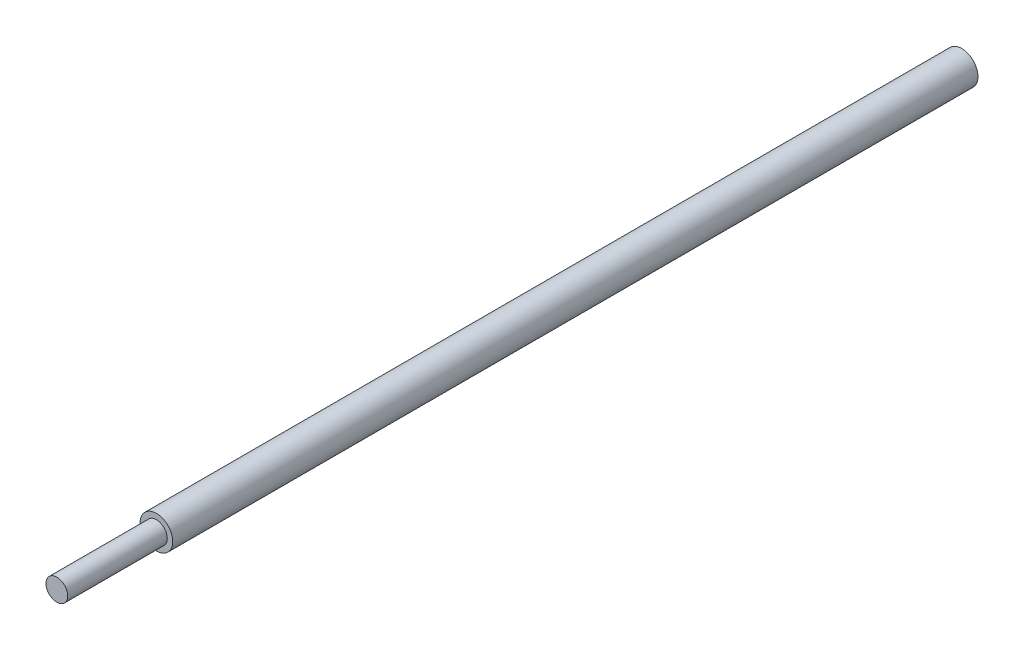
from build123d import *

# Parameters (mm, degrees)
SKETCH2_R           = 3
BOSS_EXTRUDE1_DEPTH = 83.25
SKETCH3_R           = 3
SKETCH3_R_2         = 2
CUT_EXTRUDE1_DEPTH  = 18.32


with BuildPart() as part:
    # Sketch2 → Boss-Extrude1 (new, symmetric)
    with BuildSketch(Plane.XY):
        Circle(SKETCH2_R)
    extrude(amount=BOSS_EXTRUDE1_DEPTH, both=True)

    # Sketch3 → Cut-Extrude1 (cut)
    with BuildSketch(Plane.XY.offset(83.25)):
        Circle(SKETCH3_R)
        Circle(SKETCH3_R_2, mode=Mode.SUBTRACT)
    extrude(amount=-CUT_EXTRUDE1_DEPTH, mode=Mode.SUBTRACT)


solid = part.part
